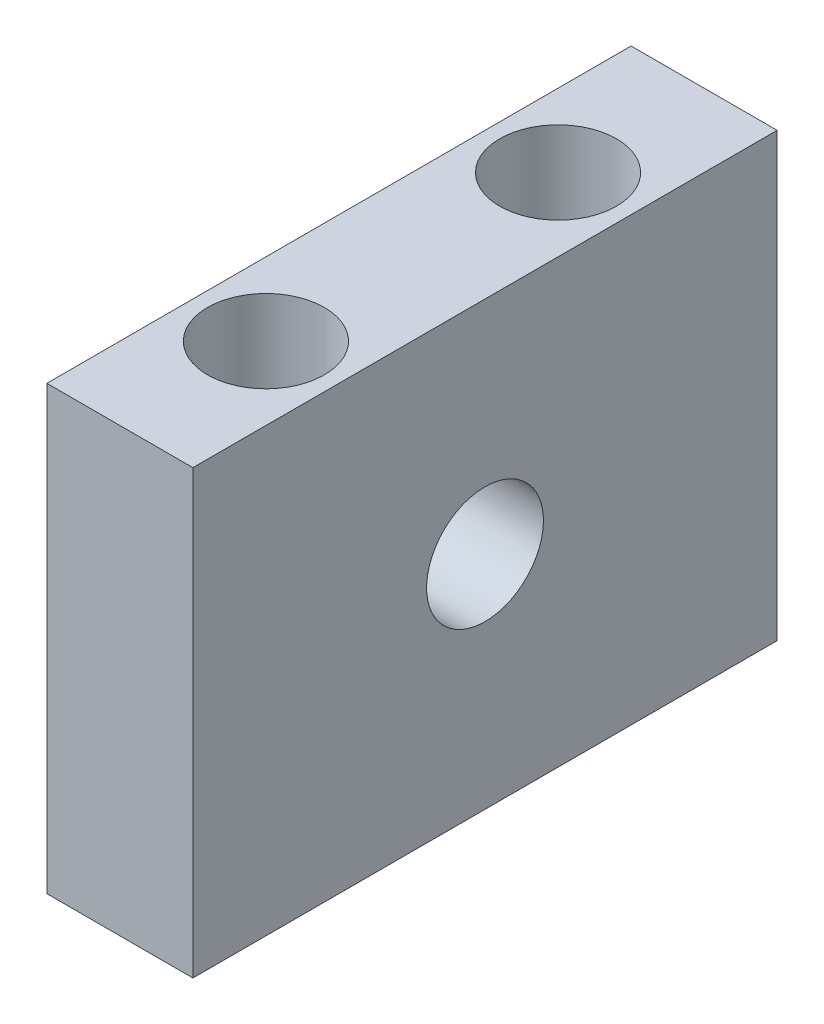
from build123d import *

# Parameters (mm, degrees)
CROQUIS1_W              = 10
CROQUIS1_H              = 40
SALIENTE_EXTRUIR1_DEPTH = 30.26
CROQUIS2_R              = 4
CORTAR_EXTRUIR1_DEPTH   = 30.26
CROQUIS5_R              = 4
CORTAR_EXTRUIR2_DEPTH   = 15.13


with BuildPart() as part:
    # Croquis1 → Saliente-Extruir1 (new body)
    with BuildSketch(Plane(origin=(0, 0, 0), x_dir=(1, 0, 0), z_dir=(0, 1, 0))):
        Rectangle(CROQUIS1_W, CROQUIS1_H)
    extrude(amount=SALIENTE_EXTRUIR1_DEPTH)

    # Croquis2 → Cortar-Extruir1 (cut)
    with BuildSketch(Plane(origin=(0, 0, 0), x_dir=(1, 0, 0), z_dir=(0, 1, 0))):
        with Locations(Location((0, -10, 0), (0, 0, 90))):
            Circle(CROQUIS2_R)
        with Locations(Location((0, 10, 0), (0, 0, 90))):
            Circle(CROQUIS2_R)
    extrude(amount=CORTAR_EXTRUIR1_DEPTH, mode=Mode.SUBTRACT)

    # Croquis5 → Cortar-Extruir2 (cut, symmetric)
    with BuildSketch(Plane(origin=(0, 0, 0), x_dir=(0, 0, -1), z_dir=(1, 0, 0))):
        with Locations((0, 15.13)):
            Circle(CROQUIS5_R)
    extrude(amount=CORTAR_EXTRUIR2_DEPTH, both=True, mode=Mode.SUBTRACT)


solid = part.part
